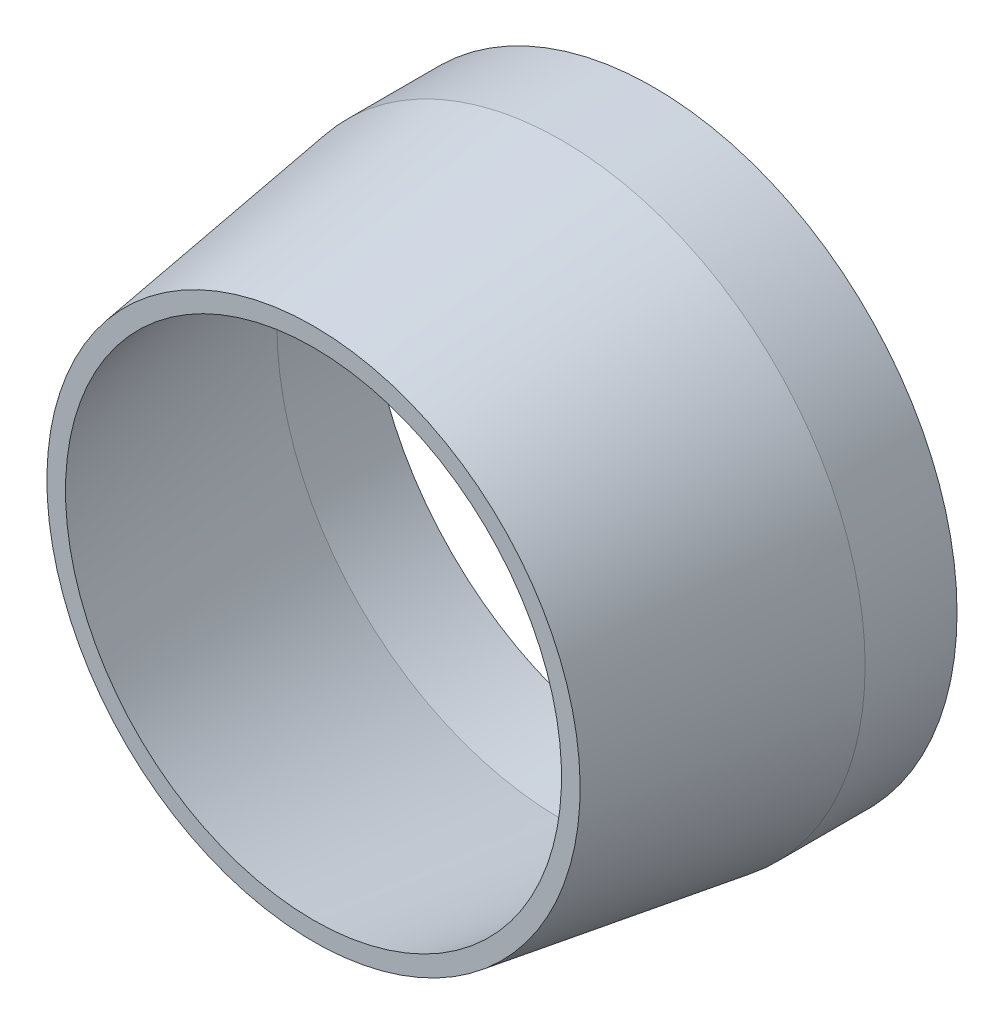
from build123d import *

# Parameters (mm, degrees)
SCHIZZO1_R                   = 3300
SCHIZZO1_R_2                 = 3100
ESTRUSIONE_ESTRUSIONE1_DEPTH = 1000


with BuildPart() as part:
    # Schizzo1 → Estrusione-Estrusione1 (new body)
    with BuildSketch(Plane.XY):
        Circle(SCHIZZO1_R)
        Circle(SCHIZZO1_R_2, mode=Mode.SUBTRACT)
    extrude(amount=ESTRUSIONE_ESTRUSIONE1_DEPTH)

    # Schizzo3 → Rivoluzione1 (revolve)
    with BuildSketch(Plane(origin=(0, 0, 0), x_dir=(0, 0, -1), z_dir=(1, 0, 0))):
        Polygon((-3700, 2697.817124978), (-3700, 2900), (-1000, 3300), (-1000, 3097.817124978), align=None)
    revolve(axis=Axis((0, 0, 1000), (0, 0, 1)))


solid = part.part
